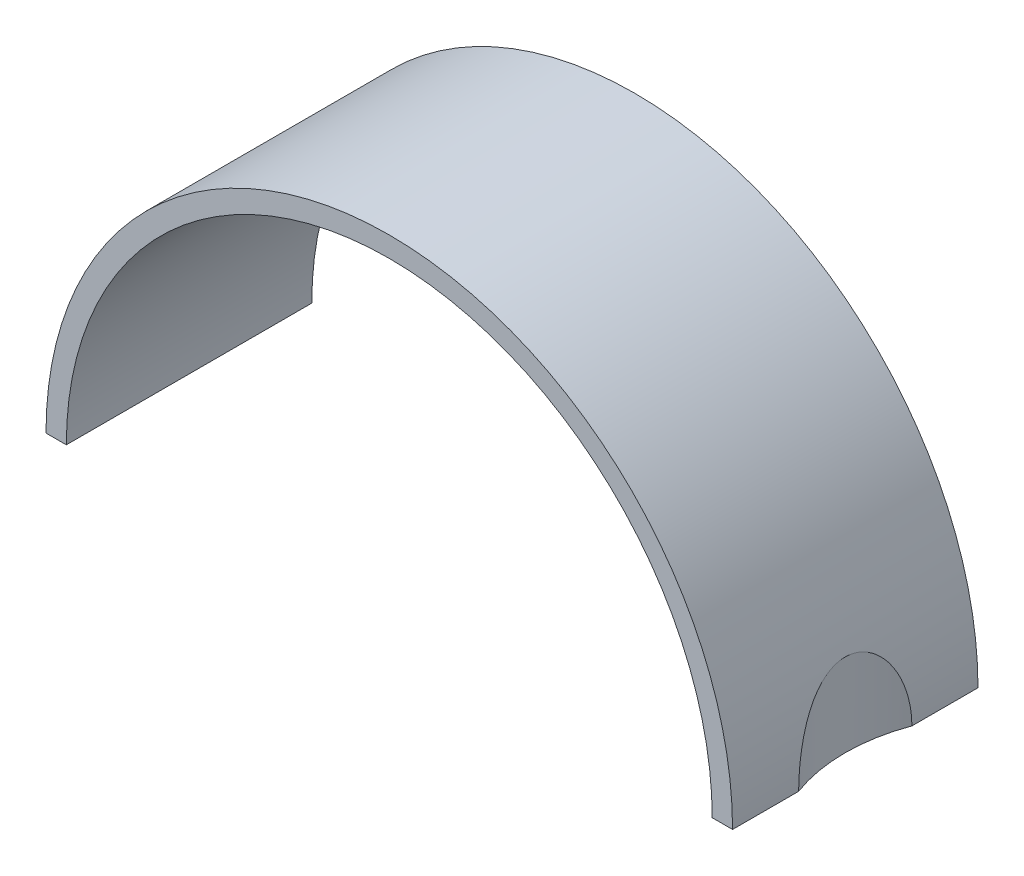
from build123d import *

# Parameters (mm, degrees)
DODANIE_WYCI_GNI_CIE1_DEPTH = 12.065
WYTNIJ_WYCI_GNI_CIE1_DEPTH  = 50.230978306


with BuildPart() as part:
    # Szkic1 → Dodanie-wyciągnięcie1 (new, symmetric)
    with BuildSketch(Plane.XY):
        with BuildLine():
            Line((33.75, 0), (31.75, 0))
            ThreePointArc((31.75, 0), (0, 31.75), (-31.75, 0))
            Line((-31.75, 0), (-33.75, 0))
            ThreePointArc((-33.75, 0), (0, 33.75), (33.75, 0))
        make_face()
    extrude(amount=DODANIE_WYCI_GNI_CIE1_DEPTH, both=True)

    # Szkic2 → Wytnij-wyciągnięcie1 (cut, through all)
    with BuildSketch(Plane(origin=(0, 0, 0), x_dir=(-1, 0, 0), z_dir=(0, -1, 0))):
        with BuildLine():
            Line((-33.75, 5.567764363), (-33.75, 0))
            Line((-33.75, 0), (-33.75, -5.567764363))
            ThreePointArc((-33.75, -5.567764363), (-32.75, 0), (-33.75, 5.567764363))
        make_face()
    wytnij_wyci_gni_cie1 = extrude(amount=-WYTNIJ_WYCI_GNI_CIE1_DEPTH, mode=Mode.SUBTRACT)

    # Lustro1: Wytnij-wyciągnięcie1 across plane
    add(wytnij_wyci_gni_cie1.mirror(Plane(origin=(0, 0, 0), x_dir=(0, 0, 1), z_dir=(1, 0, 0))), mode=Mode.SUBTRACT)


solid = part.part
